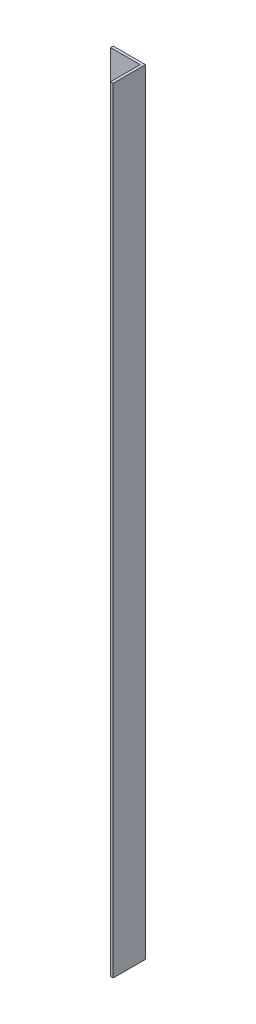
from build123d import *

# Parameters (mm, degrees)
EXTRUDE_THIN1_DEPTH = 457.2


with BuildPart() as part:
    # Sketch1 → Extrude-Thin1 (new body)
    with BuildSketch(Plane(origin=(0, 0, 0), x_dir=(1, 0, 0), z_dir=(0, 1, 0))):
        Polygon((0, 0), (0, 19.05), (-19.05, 19.05), (-19.05, 17.4625), (-1.5875, 17.4625), (-1.5875, 0), align=None)
    extrude(amount=EXTRUDE_THIN1_DEPTH)


solid = part.part
